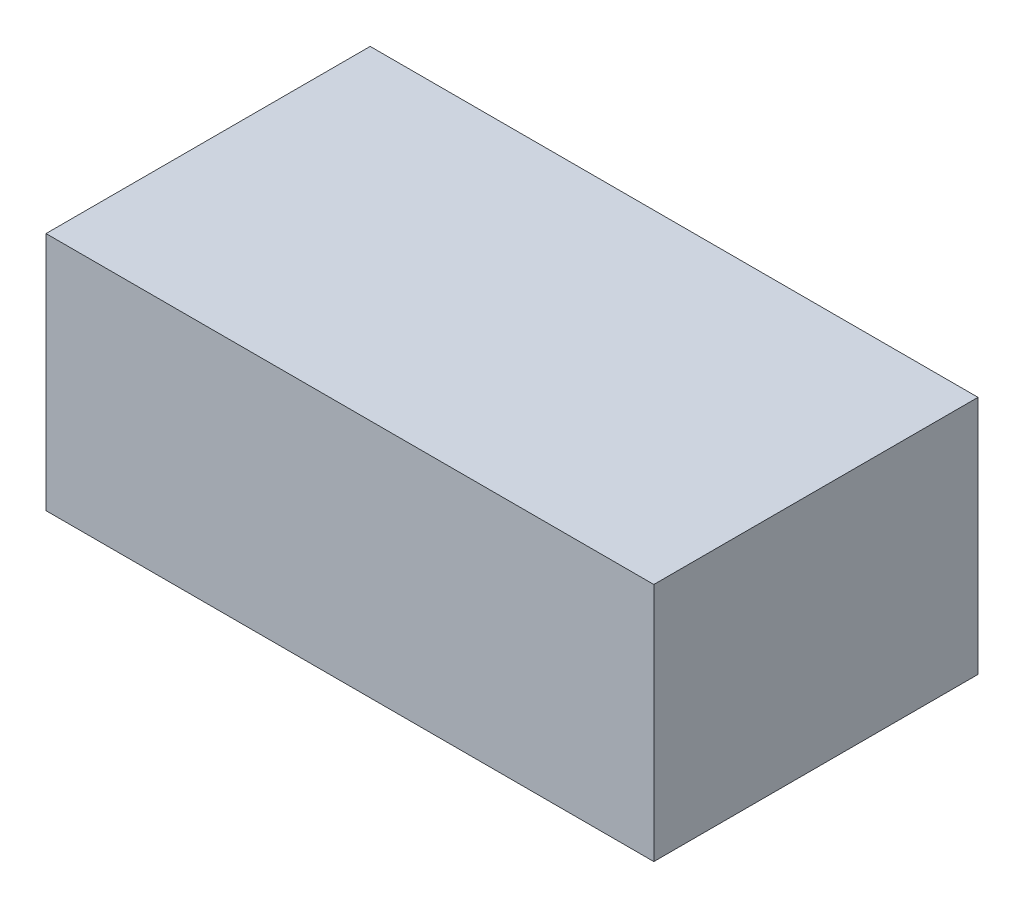
from build123d import *

# Parameters (mm, degrees)
SKETCH_1_W      = 30
SKETCH_1_H      = 16
EXTRUDE_1_DEPTH = 13
CHAMFER_1_SIZE  = 2
CHAMFER_1_SIZE2 = 1.154700538


with BuildPart() as part:
    # Эскиз1 → Бобышка-Вытянуть1 (new body)
    with BuildSketch(Plane(origin=(0, 0, 0), x_dir=(1, 0, 0), z_dir=(0, 1, 0))):
        Rectangle(SKETCH_1_W, SKETCH_1_H)
    extrude(amount=EXTRUDE_1_DEPTH)

    # Фаска1
    chamfer_1_edges = [part.edges().sort_by_distance(p)[0] for p in [
        (0, 0, 8),
        (-15, 0, 0),
        (0, 0, -8),
        (15, 0, 0),
    ]]
    chamfer_1_side = [part.faces().sort_by_distance(p)[0] for p in [
        (0, 0, 0),
    ]]
    chamfer(chamfer_1_edges, length=CHAMFER_1_SIZE, length2=CHAMFER_1_SIZE2, reference=chamfer_1_side[0])


solid = part.part
